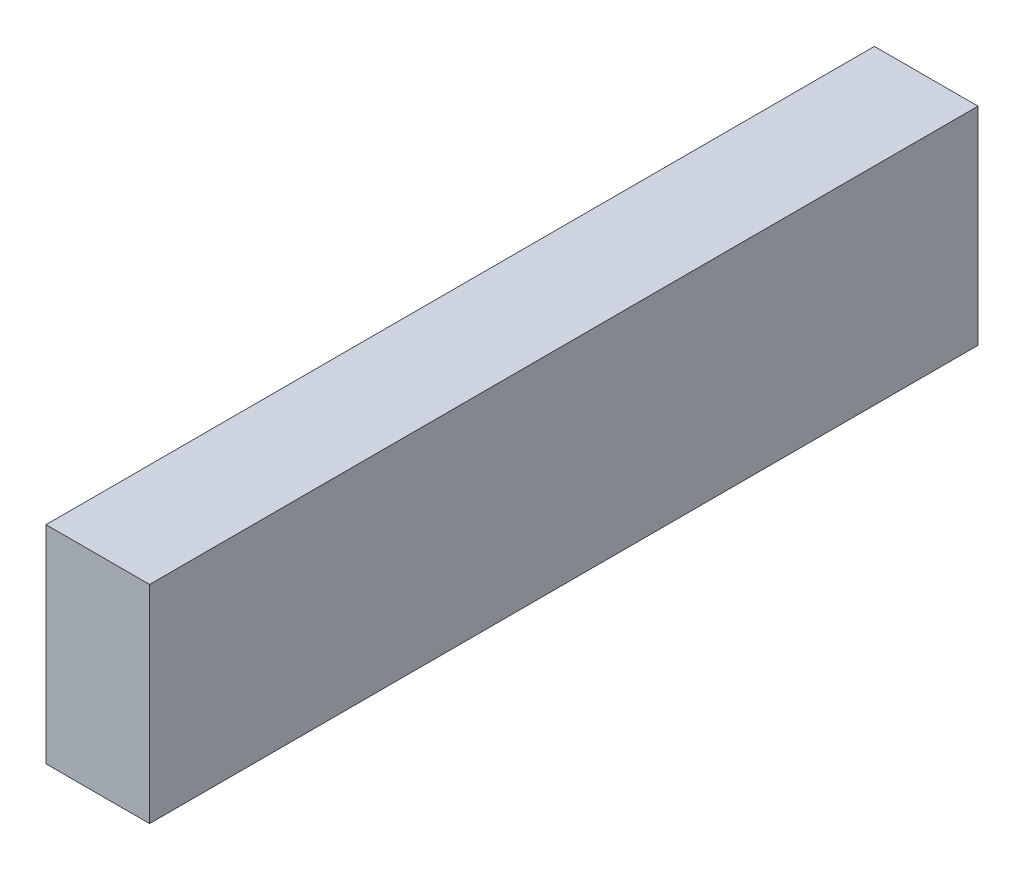
from build123d import *

# Parameters (mm, degrees)
SKETCH1_W      = 6.35
SKETCH1_H      = 12.7
EXTRUDE1_DEPTH = 50.8


with BuildPart() as part:
    # Sketch1 → Extrude1 (new body)
    with BuildSketch(Plane.XY):
        Rectangle(SKETCH1_W, SKETCH1_H)
    extrude(amount=EXTRUDE1_DEPTH)


solid = part.part
